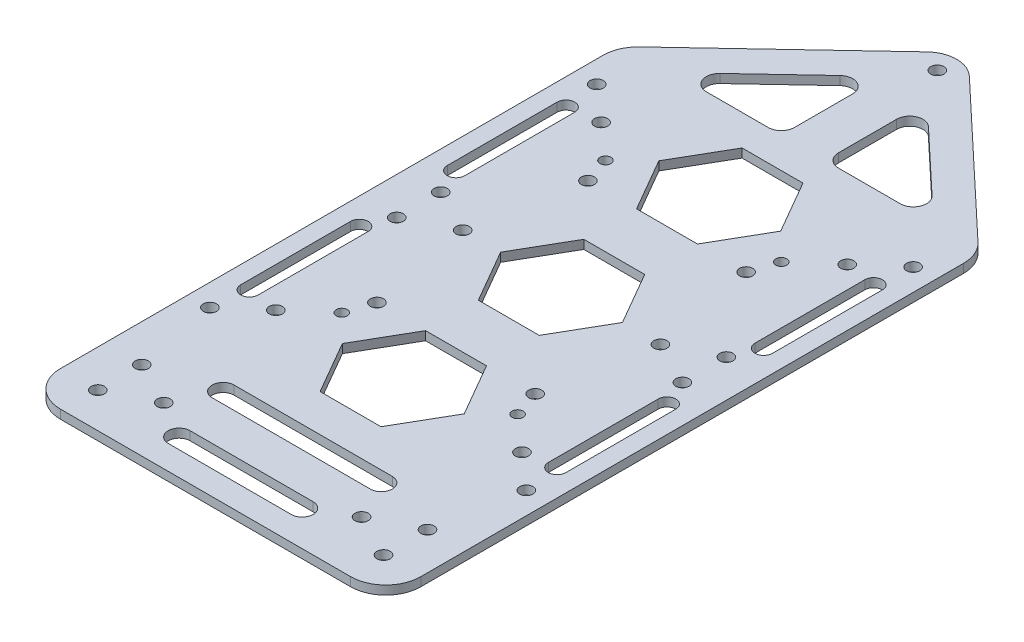
from build123d import *

# Parameters (mm, degrees)
SKETCH_1_R          = 1.25
SKETCH_1_R_2        = 1.5
EXTRUDE_1_DEPTH     = 2
CUT_EXTRUDE_1_DEPTH = 99.815339485


with BuildPart() as part:
    # 草图1 → 凸台-拉伸1 (new body)
    with BuildSketch(Plane(origin=(0, 0, 0), x_dir=(1, 0, 0), z_dir=(0, 1, 0))):
        with BuildLine():
            Line((-33, -81), (33, -81))
            ThreePointArc((33, -81), (38.656854249, -78.656854249), (41, -73))
            Line((41, -73), (41, 50.44414093))
            ThreePointArc((41, 50.44414093), (40.344059864, 53.616645416), (38.483803821, 56.268906647))
            Line((38.483803821, 56.268906647), (4.798328343, 87.982549413))
            ThreePointArc((4.798328343, 87.982549413), (0, 89.885879411), (-4.798328343, 87.982549413))
            Line((-4.798328343, 87.982549413), (-38.483803821, 56.268906647))
            ThreePointArc((-38.483803821, 56.268906647), (-40.344059864, 53.616645416), (-41, 50.44414093))
            Line((-41, 50.44414093), (-41, -73))
            ThreePointArc((-41, -73), (-38.656854249, -78.656854249), (-33, -81))
        make_face()
        with Locations(Location((-20, 30, 0), (0, 0, 270))):
            Circle(SKETCH_1_R, mode=Mode.SUBTRACT)
        with Locations(Location((20, 30, 0), (0, 0, 270))):
            Circle(SKETCH_1_R, mode=Mode.SUBTRACT)
        with Locations(Location((20, -30, 0), (0, 0, 270))):
            Circle(SKETCH_1_R, mode=Mode.SUBTRACT)
        with Locations(Location((-20, -30, 0), (0, 0, 270))):
            Circle(SKETCH_1_R, mode=Mode.SUBTRACT)
        with Locations(Location((0, 85.5, 0), (0, 0, 270))):
            Circle(SKETCH_1_R_2, mode=Mode.SUBTRACT)
        with Locations(Location((-36, 44, 0), (0, 0, 270))):
            Circle(SKETCH_1_R_2, mode=Mode.SUBTRACT)
        with Locations(Location((36, 44, 0), (0, 0, 270))):
            Circle(SKETCH_1_R_2, mode=Mode.SUBTRACT)
        with Locations(Location((36, -44, 0), (0, 0, 270))):
            Circle(SKETCH_1_R_2, mode=Mode.SUBTRACT)
        with Locations(Location((-36, -44, 0), (0, 0, 270))):
            Circle(SKETCH_1_R_2, mode=Mode.SUBTRACT)
        with Locations(Location((-32.5, 5, 0), (0, 0, 270))):
            Circle(SKETCH_1_R_2, mode=Mode.SUBTRACT)
        with Locations(Location((-32.5, -5, 0), (0, 0, 270))):
            Circle(SKETCH_1_R_2, mode=Mode.SUBTRACT)
        with Locations(Location((32.5, 5, 0), (0, 0, 270))):
            Circle(SKETCH_1_R_2, mode=Mode.SUBTRACT)
        with Locations(Location((32.5, -5, 0), (0, 0, 270))):
            Circle(SKETCH_1_R_2, mode=Mode.SUBTRACT)
        with Locations(Location((22.5, 0, 0), (0, 0, 270))):
            Circle(SKETCH_1_R_2, mode=Mode.SUBTRACT)
        with Locations(Location((-22.5, 0, 0), (0, 0, 270))):
            Circle(SKETCH_1_R_2, mode=Mode.SUBTRACT)
        with Locations(Location((-32.5, -63, 0), (0, 0, 270))):
            Circle(SKETCH_1_R_2, mode=Mode.SUBTRACT)
        with Locations(Location((-32.5, -73, 0), (0, 0, 270))):
            Circle(SKETCH_1_R_2, mode=Mode.SUBTRACT)
        with Locations(Location((-22.5, -68, 0), (0, 0, 270))):
            Circle(SKETCH_1_R_2, mode=Mode.SUBTRACT)
        with Locations(Location((32.5, -63, 0), (0, 0, 270))):
            Circle(SKETCH_1_R_2, mode=Mode.SUBTRACT)
        with Locations(Location((22.5, -68, 0), (0, 0, 270))):
            Circle(SKETCH_1_R_2, mode=Mode.SUBTRACT)
        with Locations(Location((32.5, -73, 0), (0, 0, 270))):
            Circle(SKETCH_1_R_2, mode=Mode.SUBTRACT)
        with Locations(Location((-18, 24, 0), (0, 0, 270))):
            Circle(SKETCH_1_R_2, mode=Mode.SUBTRACT)
        with Locations(Location((18, 24, 0), (0, 0, 270))):
            Circle(SKETCH_1_R_2, mode=Mode.SUBTRACT)
        with Locations(Location((18, -24, 0), (0, 0, 270))):
            Circle(SKETCH_1_R_2, mode=Mode.SUBTRACT)
        with Locations(Location((-18, -24, 0), (0, 0, 270))):
            Circle(SKETCH_1_R_2, mode=Mode.SUBTRACT)
        with Locations(Location((-28, 37, 0), (0, 0, 270))):
            Circle(SKETCH_1_R_2, mode=Mode.SUBTRACT)
        with Locations(Location((28, 37, 0), (0, 0, 270))):
            Circle(SKETCH_1_R_2, mode=Mode.SUBTRACT)
        with Locations(Location((-28, -37, 0), (0, 0, 270))):
            Circle(SKETCH_1_R_2, mode=Mode.SUBTRACT)
        with Locations(Location((28, -37, 0), (0, 0, 270))):
            Circle(SKETCH_1_R_2, mode=Mode.SUBTRACT)
        with BuildLine():
            Line((-37, 11), (-37, 36))
            ThreePointArc((-37, 36), (-35, 38), (-33, 36))
            Line((-33, 36), (-33, 11))
            ThreePointArc((-33, 11), (-35, 9), (-37, 11))
        make_face(mode=Mode.SUBTRACT)
        with BuildLine():
            Line((33, 11), (33, 36))
            ThreePointArc((33, 36), (35, 38), (37, 36))
            Line((37, 36), (37, 11))
            ThreePointArc((37, 11), (35, 9), (33, 11))
        make_face(mode=Mode.SUBTRACT)
        with BuildLine():
            Line((33, -36), (33, -11))
            ThreePointArc((33, -11), (35, -9), (37, -11))
            Line((37, -11), (37, -36))
            ThreePointArc((37, -36), (35, -38), (33, -36))
        make_face(mode=Mode.SUBTRACT)
        with BuildLine():
            Line((-37, -36), (-37, -11))
            ThreePointArc((-37, -11), (-35, -9), (-33, -11))
            Line((-33, -11), (-33, -36))
            ThreePointArc((-33, -36), (-35, -38), (-37, -36))
        make_face(mode=Mode.SUBTRACT)
    extrude(amount=EXTRUDE_1_DEPTH)

    # 草图3 → 切除-拉伸1 (cut, through all)
    with BuildSketch(Plane(origin=(0, 2, 0), x_dir=(1, 0, 0), z_dir=(0, 1, 0))):
        with BuildLine():
            Line((-22.0566638, 55), (-8, 55))
            ThreePointArc((-8, 55), (-5.878679656, 55.878679656), (-5, 58))
            Line((-5, 58), (-5, 71.233834699))
            ThreePointArc((-5, 71.233834699), (-6.810310818, 73.987857148), (-10.056426433, 73.418121843))
            Line((-10.056426433, 73.418121843), (-24.113090232, 60.184287144))
            ThreePointArc((-24.113090232, 60.184287144), (-24.845289037, 56.893849339), (-22.0566638, 55))
        make_face()
        with BuildLine():
            Line((22.0566638, 55), (8, 55))
            ThreePointArc((8, 55), (5.878679656, 55.878679656), (5, 58))
            Line((5, 58), (5, 71.233834699))
            ThreePointArc((5, 71.233834699), (6.810310818, 73.987857148), (10.056426433, 73.418121843))
            Line((10.056426433, 73.418121843), (24.113090232, 60.184287144))
            ThreePointArc((24.113090232, 60.184287144), (24.845289037, 56.893849339), (22.0566638, 55))
        make_face()
        Polygon((6.92820323, 12), (-6.92820323, 12), (-13.856406461, 0), (-6.92820323, -12), (6.92820323, -12), (13.856406461, 0), align=None)
        Polygon((13.856406461, 36), (6.92820323, 48), (-6.92820323, 48), (-13.856406461, 36), (-6.92820323, 24), (6.92820323, 24), align=None)
        Polygon((13.856406461, -36), (6.92820323, -24), (-6.92820323, -24), (-13.856406461, -36), (-6.92820323, -48), (6.92820323, -48), align=None)
        with BuildLine():
            Line((-14, -70.5), (14, -70.5))
            ThreePointArc((14, -70.5), (16.5, -73), (14, -75.5))
            Line((14, -75.5), (-14, -75.5))
            ThreePointArc((-14, -75.5), (-16.5, -73), (-14, -70.5))
        make_face()
        with BuildLine():
            Line((-18, -56.5), (18, -56.5))
            ThreePointArc((18, -56.5), (20.5, -59), (18, -61.5))
            Line((18, -61.5), (-18, -61.5))
            ThreePointArc((-18, -61.5), (-20.5, -59), (-18, -56.5))
        make_face()
    extrude(amount=-CUT_EXTRUDE_1_DEPTH, mode=Mode.SUBTRACT)


solid = part.part
